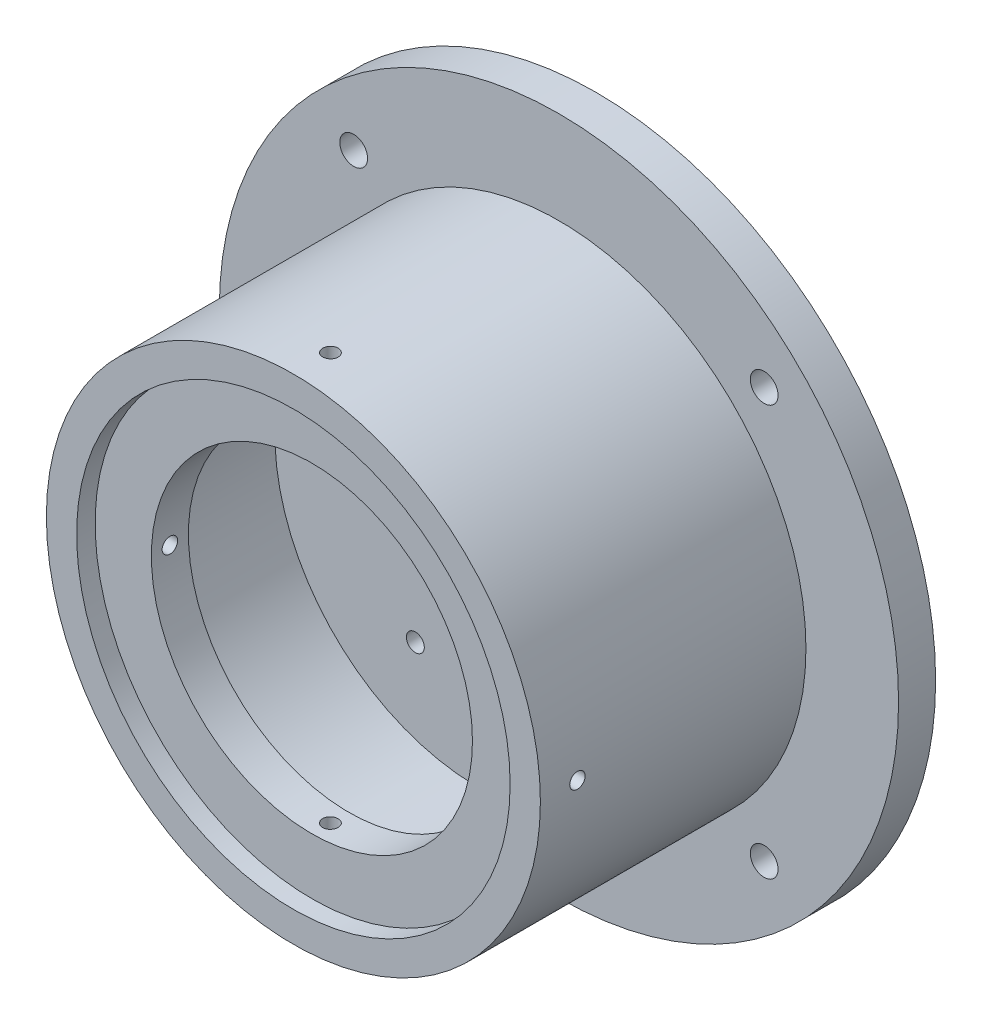
from build123d import *

# Parameters (mm, degrees)
BRIDA_START                               = 10
SK_BRIDA_R                                = 55
BRIDA_DEPTH                               = 6
TUBO_START                                = 16
SK_TUBO_R                                 = 40
SK_TUBO_R_2                               = 33
TUBO_DEPTH                                = 34
ARO_RODAMIENTO_START                      = 50
SK_ARO_RODAMIENTO_R                       = 40
SK_ARO_RODAMIENTO_R_2                     = 26
ARO_RODAMIENTO_DEPTH                      = 6
ASIENTO_ARANDELA_ALOJAMIENTO_51110_START  = 56
SK_ASIENTO_ARANDELA_ALOJAMIENTO_51110_R   = 40
SK_ASIENTO_ARANDELA_ALOJAMIENTO_51110_R_2 = 35.1
ASIENTO_ARANDELA_ALOJAMIENTO_51110_DEPTH  = 3
PLACA_MOTOR_START                         = 23
SK_PLACA_MOTOR_R                          = 33
PLACA_MOTOR_DEPTH                         = 6
HUECO_BRIDA_START                         = 10
SK_HUECO_BRIDA_R                          = 28
HUECO_BRIDA_DEPTH                         = 13
CENTRO_MOTOR_START                        = 23
SK_CENTRO_MOTOR_R                         = 8
CENTRO_MOTOR_DEPTH                        = 6
PASANTES_M2_5_MOTOR_START                 = 23
SK_PASANTES_M2_5_MOTOR_R                  = 1.45
PASANTES_M2_5_MOTOR_DEPTH                 = 6
PASANTES_M4_BRIDA_START                   = 10
SK_PASANTES_M4_BRIDA_R                    = 2.25
PASANTES_M4_BRIDA_DEPTH                   = 6
ROSCA_M3_CUBIERTA_A_DEPTH                 = 98.626840572
ROSCA_M3_CUBIERTA_A_DEPTH_BACK            = 98.626840572
CROQUIS1_R                                = 1.25
ROSCA_M3_CUBIERTA_B_DEPTH                 = 98.626840632
ROSCA_M3_CUBIERTA_B_DEPTH_BACK            = 98.626840632
CROQUIS2_R                                = 1.25


with BuildPart() as part:
    # Sk_Brida → Brida (new body)
    with BuildSketch(Plane.XY.offset(BRIDA_START)):
        Circle(SK_BRIDA_R)
    extrude(amount=BRIDA_DEPTH)

    # Sk_Tubo → Tubo (add)
    with BuildSketch(Plane.XY.offset(TUBO_START)):
        Circle(SK_TUBO_R)
        Circle(SK_TUBO_R_2, mode=Mode.SUBTRACT)
    extrude(amount=TUBO_DEPTH)

    # Sk_Aro_rodamiento → Aro_rodamiento (add)
    with BuildSketch(Plane.XY.offset(ARO_RODAMIENTO_START)):
        Circle(SK_ARO_RODAMIENTO_R)
        Circle(SK_ARO_RODAMIENTO_R_2, mode=Mode.SUBTRACT)
    extrude(amount=ARO_RODAMIENTO_DEPTH)

    # Sk_Asiento_arandela_alojamiento_51110 → Asiento_arandela_alojamiento_51110 (add)
    with BuildSketch(Plane.XY.offset(ASIENTO_ARANDELA_ALOJAMIENTO_51110_START)):
        Circle(SK_ASIENTO_ARANDELA_ALOJAMIENTO_51110_R)
        Circle(SK_ASIENTO_ARANDELA_ALOJAMIENTO_51110_R_2, mode=Mode.SUBTRACT)
    extrude(amount=ASIENTO_ARANDELA_ALOJAMIENTO_51110_DEPTH)

    # Sk_Placa_motor → Placa_motor (add)
    with BuildSketch(Plane.XY.offset(PLACA_MOTOR_START)):
        Circle(SK_PLACA_MOTOR_R)
    extrude(amount=PLACA_MOTOR_DEPTH)

    # Sk_Hueco_brida → Hueco_brida (cut)
    with BuildSketch(Plane.XY.offset(HUECO_BRIDA_START)):
        Circle(SK_HUECO_BRIDA_R)
    extrude(amount=HUECO_BRIDA_DEPTH, mode=Mode.SUBTRACT)

    # Sk_Centro_motor → Centro_motor (cut)
    with BuildSketch(Plane.XY.offset(CENTRO_MOTOR_START)):
        Circle(SK_CENTRO_MOTOR_R)
    extrude(amount=CENTRO_MOTOR_DEPTH, mode=Mode.SUBTRACT)

    # Sk_Pasantes_M2-5_motor → Pasantes_M2-5_motor (cut)
    with BuildSketch(Plane.XY.offset(PASANTES_M2_5_MOTOR_START)):
        with Locations((20.5, 0)):
            Circle(SK_PASANTES_M2_5_MOTOR_R)
        with Locations((10.25, 17.753520778)):
            Circle(SK_PASANTES_M2_5_MOTOR_R)
        with Locations((-10.25, 17.753520778)):
            Circle(SK_PASANTES_M2_5_MOTOR_R)
        with Locations((-20.5, 0)):
            Circle(SK_PASANTES_M2_5_MOTOR_R)
        with Locations((-10.25, -17.753520778)):
            Circle(SK_PASANTES_M2_5_MOTOR_R)
        with Locations((10.25, -17.753520778)):
            Circle(SK_PASANTES_M2_5_MOTOR_R)
    extrude(amount=PASANTES_M2_5_MOTOR_DEPTH, mode=Mode.SUBTRACT)

    # Sk_Pasantes_M4_brida → Pasantes_M4_brida (cut)
    with BuildSketch(Plane.XY.offset(PASANTES_M4_BRIDA_START)):
        with Locations((33.234018716, 33.234018716)):
            Circle(SK_PASANTES_M4_BRIDA_R)
        with Locations((-33.234018716, 33.234018716)):
            Circle(SK_PASANTES_M4_BRIDA_R)
        with Locations((-33.234018716, -33.234018716)):
            Circle(SK_PASANTES_M4_BRIDA_R)
        with Locations((33.234018716, -33.234018716)):
            Circle(SK_PASANTES_M4_BRIDA_R)
    extrude(amount=PASANTES_M4_BRIDA_DEPTH, mode=Mode.SUBTRACT)

    # Croquis1 → Rosca_M3_cubierta_A (cut, two sides: drawn at the far end of the back side and taken through both)
    with BuildSketch(Plane(origin=(0, 0, 0), x_dir=(1, 0, 0), z_dir=(0, 1, 0)).offset(-ROSCA_M3_CUBIERTA_A_DEPTH_BACK)):
        with Locations(Location((0, -53, 0), (0, 0, 270))):
            Circle(CROQUIS1_R)
    extrude(amount=ROSCA_M3_CUBIERTA_A_DEPTH + ROSCA_M3_CUBIERTA_A_DEPTH_BACK, mode=Mode.SUBTRACT)

    # Croquis2 → Rosca_M3_cubierta_B (cut, two sides: drawn at the far end of the back side and taken through both)
    with BuildSketch(Plane(origin=(0, 0, 0), x_dir=(0, 0, -1), z_dir=(1, 0, 0)).offset(-ROSCA_M3_CUBIERTA_B_DEPTH_BACK)):
        with Locations((-53, 0)):
            Circle(CROQUIS2_R)
    extrude(amount=ROSCA_M3_CUBIERTA_B_DEPTH + ROSCA_M3_CUBIERTA_B_DEPTH_BACK, mode=Mode.SUBTRACT)


solid = part.part
